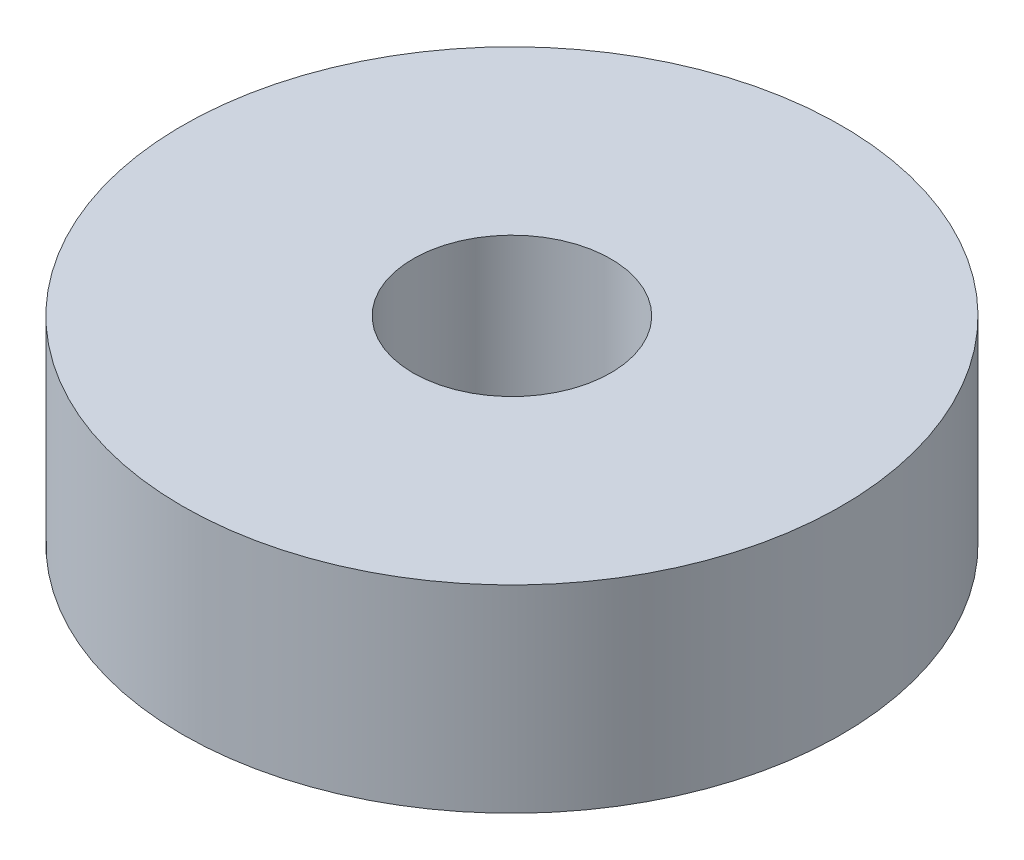
from build123d import *

# Parameters (mm, degrees)
SKETCH1_R           = 5
SKETCH1_R_2         = 1.5
BOSS_EXTRUDE1_DEPTH = 3


with BuildPart() as part:
    # Sketch1 → Boss-Extrude1 (new body)
    with BuildSketch(Plane(origin=(0, 0, 0), x_dir=(1, 0, 0), z_dir=(0, 1, 0))):
        with Locations(Location((0, 0, 0), (0, 0, 270))):
            Circle(SKETCH1_R)
        with Locations(Location((0, 0, 0), (0, 0, 270))):
            Circle(SKETCH1_R_2, mode=Mode.SUBTRACT)
    extrude(amount=BOSS_EXTRUDE1_DEPTH)


solid = part.part
